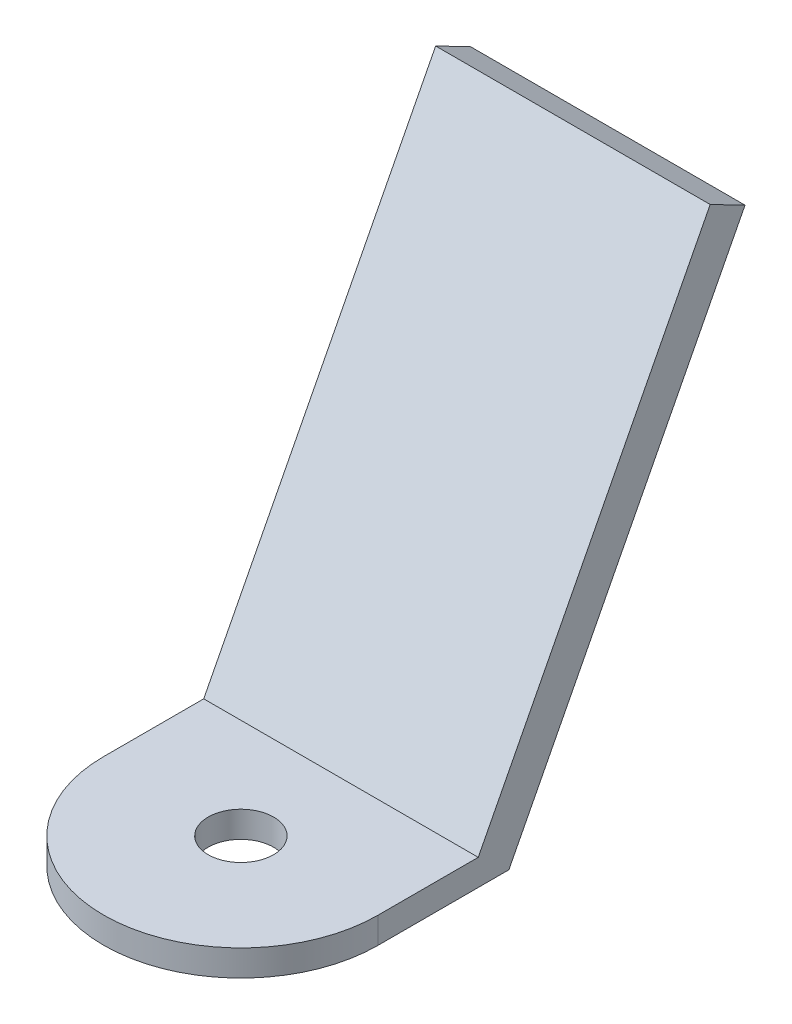
from build123d import *

# Parameters (mm, degrees)
SKETCH1_R           = 2.5
BOSS_EXTRUDE1_DEPTH = 2
BOSS_EXTRUDE3_DEPTH = 21


with BuildPart() as part:
    # Sketch1 → Boss-Extrude1 (new body)
    with BuildSketch(Plane(origin=(0, 0, 0), x_dir=(1, 0, 0), z_dir=(0, 1, 0))):
        with BuildLine():
            Line((-10.5, 0), (-10.5, 10))
            Line((-10.5, 10), (10.5, 10))
            Line((10.5, 10), (10.5, 0))
            ThreePointArc((10.5, 0), (0, -10.5), (-10.5, 0))
        make_face()
        with Locations(Location((0, 0, 0), (0, 0, 270))):
            Circle(SKETCH1_R, mode=Mode.SUBTRACT)
    extrude(amount=BOSS_EXTRUDE1_DEPTH)

    # Sketch3 → Boss-Extrude3 (add)
    with BuildSketch(Plane(origin=(10.5, 0, 0), x_dir=(0, 0, -1), z_dir=(1, 0, 0))):
        Polygon((10, 0), (19.91, 19.2), (28.065104167, 35), (25.39926045, 36.375964127), (6.623958132, 0), align=None)
    extrude(amount=-BOSS_EXTRUDE3_DEPTH)


solid = part.part
